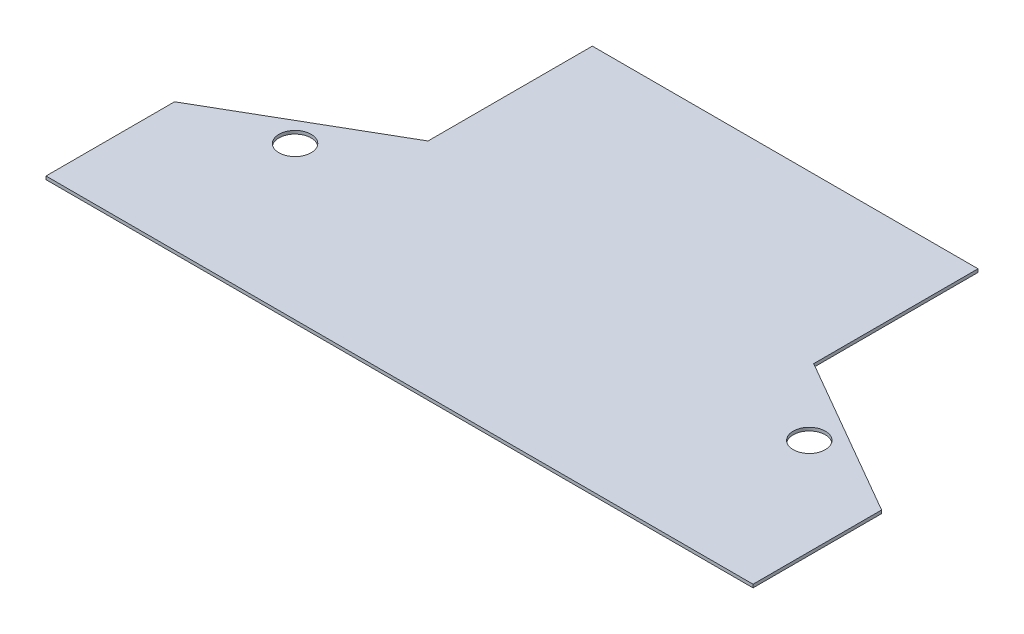
from build123d import *

# Parameters (mm, degrees)
SKETCH1_R           = 0.5
BOSS_EXTRUDE1_DEPTH = 0.1


with BuildPart() as part:
    # Sketch1 → Boss-Extrude1 (new body)
    with BuildSketch(Plane(origin=(0, 0, 0), x_dir=(1, 0, 0), z_dir=(0, 1, 0))):
        Polygon((-22, 4), (-17, 6.887), (-17, 12), (-5, 12), (-5, 6.887), (0, 4), (0, 0), (-22, 0), align=None)
        with Locations(Location((-19, 4.75, 0), (0, 0, 270))):
            Circle(SKETCH1_R, mode=Mode.SUBTRACT)
        with Locations(Location((-3, 4.75, 0), (0, 0, 270))):
            Circle(SKETCH1_R, mode=Mode.SUBTRACT)
    extrude(amount=BOSS_EXTRUDE1_DEPTH)


solid = part.part
